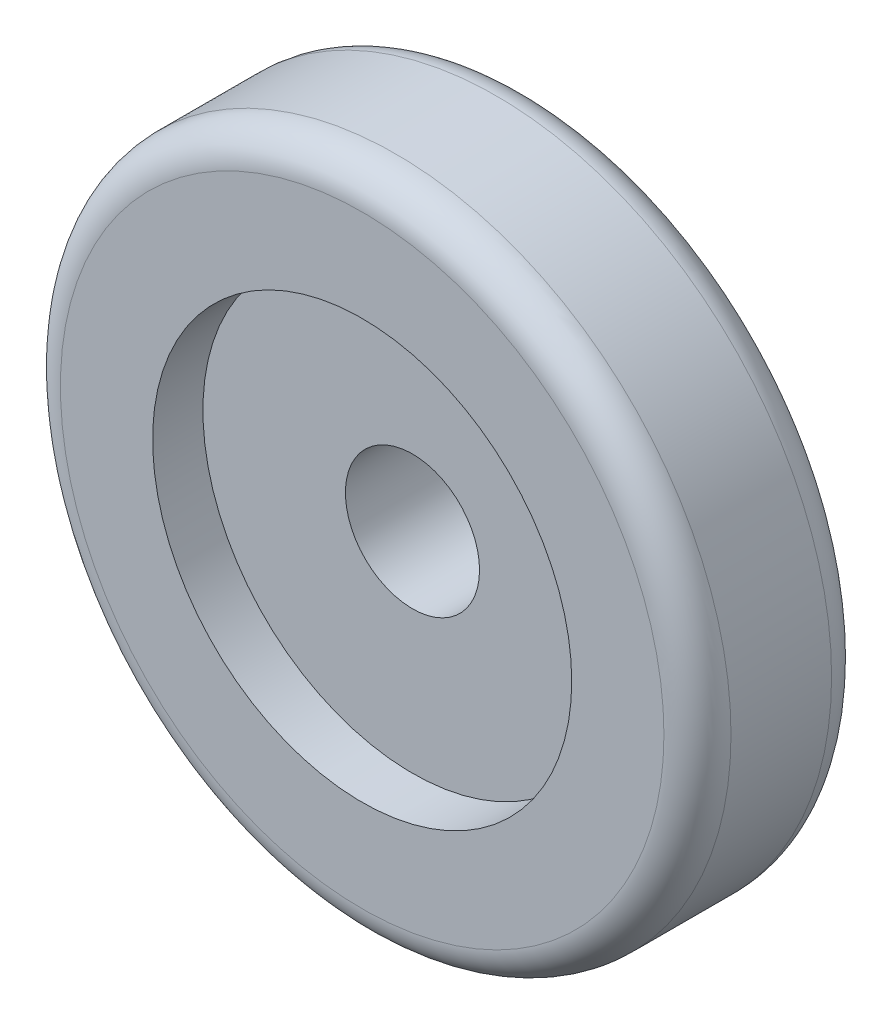
from build123d import *

# Parameters (mm, degrees)
SKETCH1_R           = 20
BOSS_EXTRUDE1_DEPTH = 10
SKETCH2_R           = 4
CUT_EXTRUDE1_DEPTH  = 31
SKETCH3_R           = 12.5
CUT_EXTRUDE2_DEPTH  = 3
FILLET1_R           = 2


with BuildPart() as part:
    # Sketch1 → Boss-Extrude1 (new body)
    with BuildSketch(Plane.XY):
        Circle(SKETCH1_R)
    extrude(amount=BOSS_EXTRUDE1_DEPTH)

    # Sketch2 → Cut-Extrude1 (cut, through all)
    with BuildSketch(Plane.XY.offset(10)):
        Circle(SKETCH2_R)
    extrude(amount=-CUT_EXTRUDE1_DEPTH, mode=Mode.SUBTRACT)

    # Sketch3 → Cut-Extrude2 (cut)
    with BuildSketch(Plane.XY.offset(10)):
        Circle(SKETCH3_R)
    extrude(amount=-CUT_EXTRUDE2_DEPTH, mode=Mode.SUBTRACT)

    # Fillet1
    fillet1_edges = [part.edges().sort_by_distance(p)[0] for p in [
        (-20, 0, 0),
        (-20, 0, 10),
    ]]
    fillet(fillet1_edges, radius=FILLET1_R)


solid = part.part
